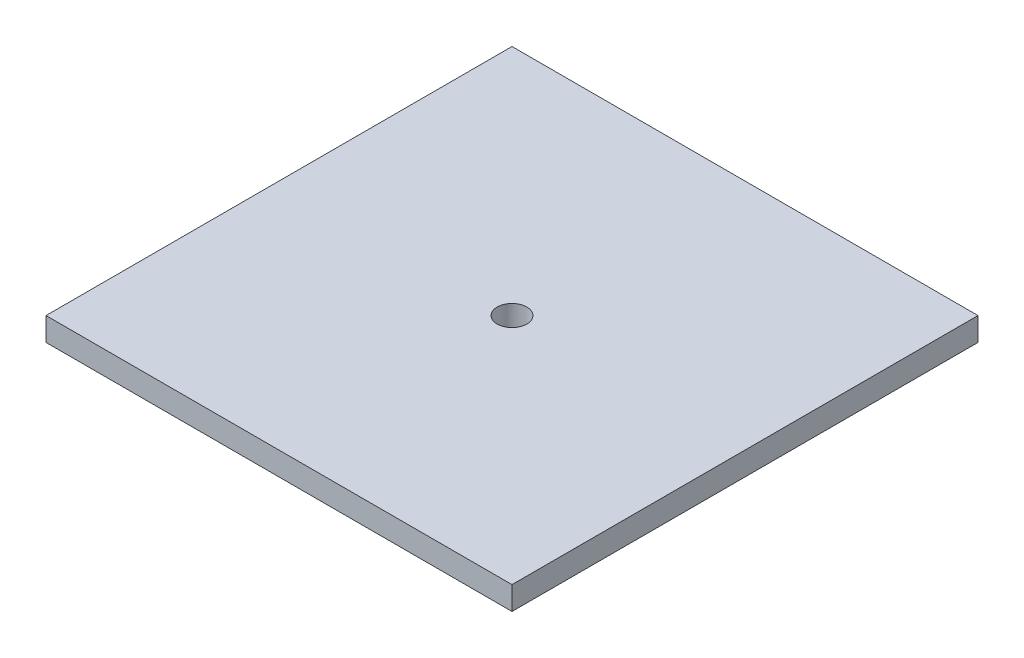
from build123d import *

# Parameters (mm, degrees)
SKETCH1_W           = 100
SKETCH1_H           = 100
SKETCH1_R           = 3.175
BOSS_EXTRUDE1_DEPTH = 5


with BuildPart() as part:
    # Sketch1 → Boss-Extrude1 (new body)
    with BuildSketch(Plane(origin=(0, 0, 0), x_dir=(1, 0, 0), z_dir=(0, 1, 0))):
        Rectangle(SKETCH1_W, SKETCH1_H)
        with Locations(Location((0, 0, 0), (0, 0, 270))):
            Circle(SKETCH1_R, mode=Mode.SUBTRACT)
    extrude(amount=BOSS_EXTRUDE1_DEPTH)


solid = part.part
